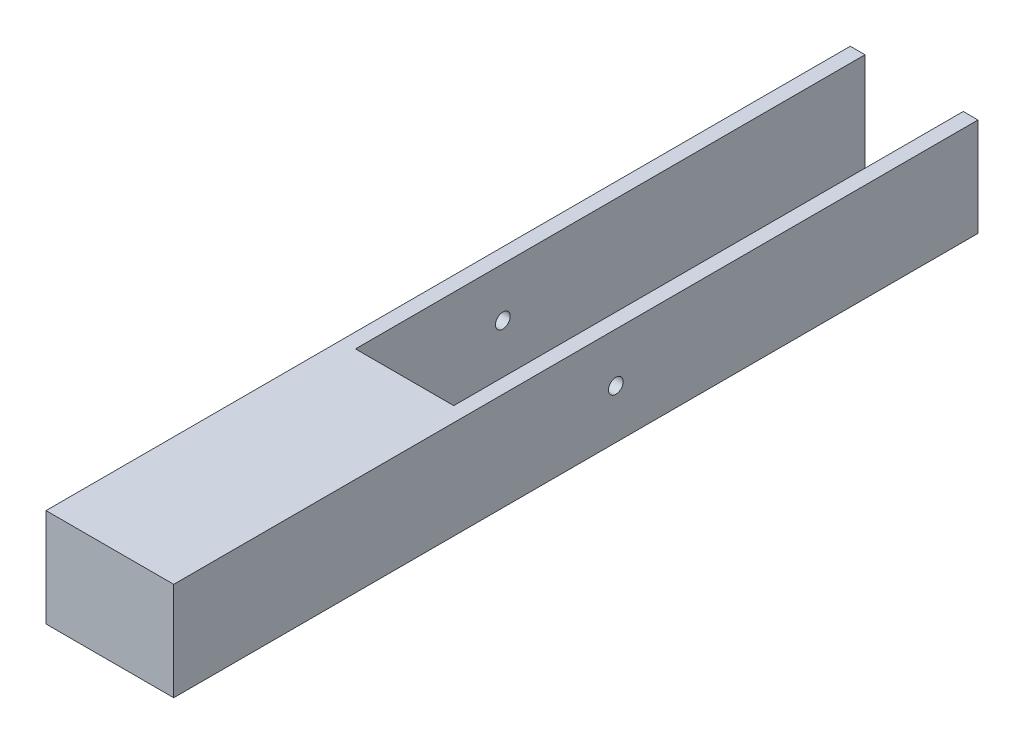
from build123d import *

# Parameters (mm, degrees)
SKETCH2_W           = 25.4
SKETCH2_H           = 25.4
BOSS_EXTRUDE1_DEPTH = 76.2
SKETCH3_W           = 207.924844479
SKETCH3_H           = 25.4
BOSS_EXTRUDE2_DEPTH = 3.81
SKETCH4_W           = 207.924844479
SKETCH4_H           = 25.4
BOSS_EXTRUDE3_DEPTH = 3.81
SKETCH5_R           = 1.905
CUT_EXTRUDE1_DEPTH  = 139.155401824


with BuildPart() as part:
    # Sketch2 → Boss-Extrude1 (new body)
    with BuildSketch(Plane.XY):
        with Locations((12.7, 12.7)):
            Rectangle(SKETCH2_W, SKETCH2_H)
    extrude(amount=BOSS_EXTRUDE1_DEPTH)

    # Sketch3 → Boss-Extrude2 (add)
    with BuildSketch(Plane(origin=(25.4, 0, 0), x_dir=(0, 0, -1), z_dir=(1, 0, 0))):
        with Locations((27.76242224, 12.7)):
            Rectangle(SKETCH3_W, SKETCH3_H)
    extrude(amount=BOSS_EXTRUDE2_DEPTH)

    # Sketch4 → Boss-Extrude3 (add)
    with BuildSketch(Plane.ZY):
        with Locations((-27.76242224, 12.7)):
            Rectangle(SKETCH4_W, SKETCH4_H)
    extrude(amount=BOSS_EXTRUDE3_DEPTH)

    # Sketch5 → Cut-Extrude1 (cut, through all)
    with BuildSketch(Plane.ZY.offset(3.81)):
        with Locations((-38.1, 12.7)):
            Circle(SKETCH5_R)
    extrude(amount=-CUT_EXTRUDE1_DEPTH, mode=Mode.SUBTRACT)


solid = part.part
